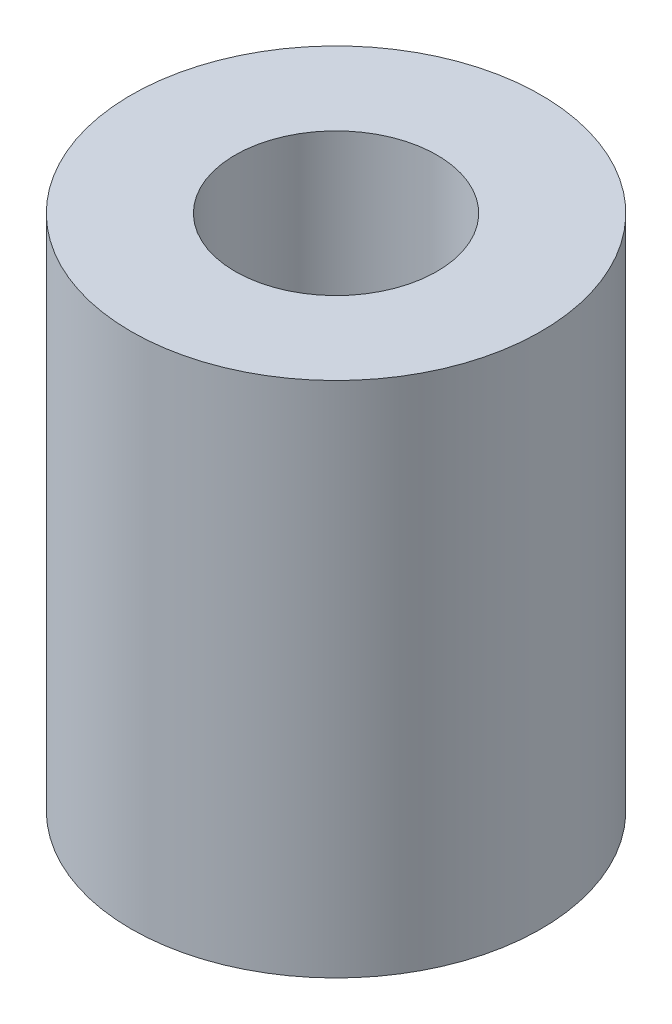
from build123d import *

# Parameters (mm, degrees)
CROQUIS1_R              = 9.9
CROQUIS1_R_2            = 4.875
SALIENTE_EXTRUIR1_DEPTH = 25


with BuildPart() as part:
    # Croquis1 → Saliente-Extruir1 (new body)
    with BuildSketch(Plane(origin=(0, 0, 0), x_dir=(1, 0, 0), z_dir=(0, 1, 0))):
        with Locations(Location((0, 0, 0), (0, 0, 270))):
            Circle(CROQUIS1_R)
        with Locations(Location((0, 0, 0), (0, 0, 270))):
            Circle(CROQUIS1_R_2, mode=Mode.SUBTRACT)
    extrude(amount=SALIENTE_EXTRUIR1_DEPTH)


solid = part.part
